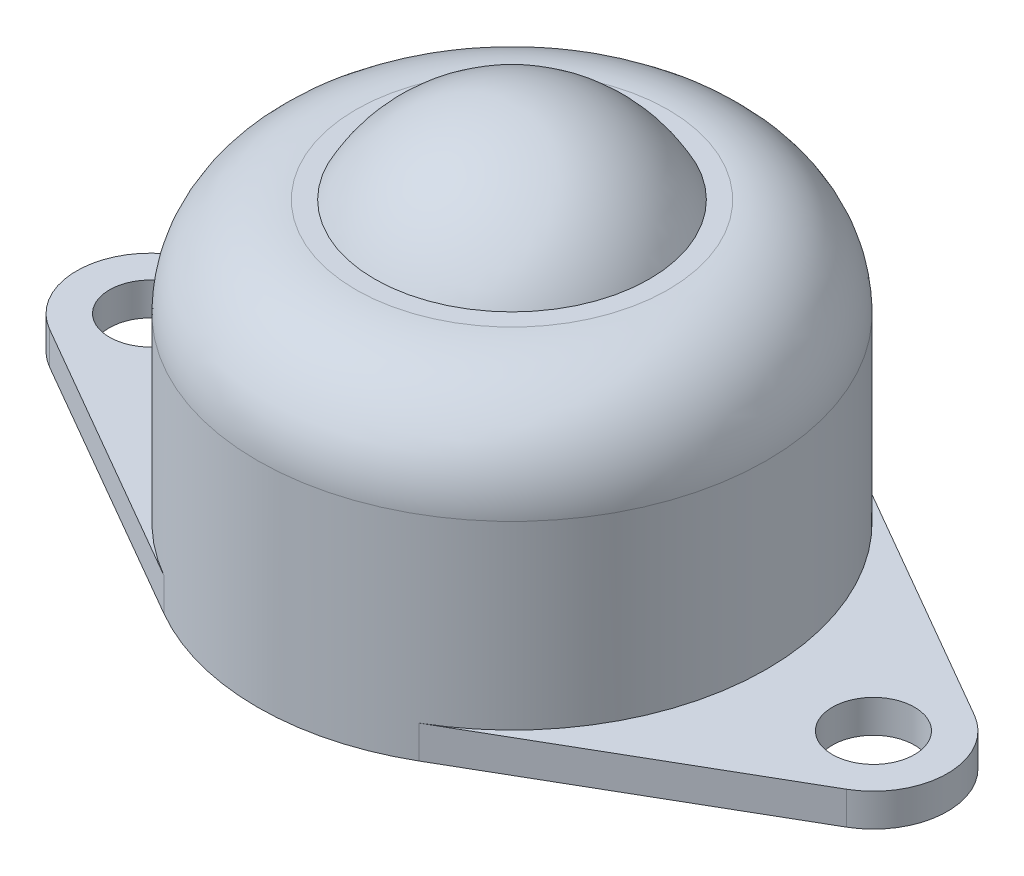
from build123d import *

# Parameters (mm, degrees)
EXTRUDE_START   = -2
SKETCH_2_R      = 2.5
EXTRUDE_1_DEPTH = 2


with BuildPart() as part:
    # 草图1 → 旋转1 (revolve)
    with BuildSketch(Plane.XY, mode=Mode.PRIVATE) as revolve_1_sk:
        with BuildLine():
            Line((0, -14.5), (15.5, -14.5))
            Line((15.5, -14.5), (15.5, -1.5))
            ThreePointArc((15.5, -1.5), (13.742640687, 2.742640687), (9.5, 4.5))
            Line((9.5, 4.5), (8.366600265, 4.5))
            ThreePointArc((8.366600265, 4.5), (4.873397172, 8.154753215), (0, 9.5))
            Line((0, 9.5), (0, -14.5))
        make_face()
    revolve(revolve_1_sk.sketch.rotate(Axis((0, 9.5, 0), (0, -1, 0)), 90), axis=Axis((0, 9.5, 0), (0, -1, 0)))

    # 草图2 → 凸台-拉伸1 (add)
    with BuildSketch(Plane.XZ.offset(14.5).offset(EXTRUDE_START)):
        with BuildLine():
            Line((-24.25, 3.897114317), (-7.75, 13.423393759))
            ThreePointArc((-7.75, 13.423393759), (0, 15.5), (7.75, 13.423393759))
            Line((7.75, 13.423393759), (24.25, 3.897114317))
            ThreePointArc((24.25, 3.897114317), (26.5, 0), (24.25, -3.897114317))
            Line((24.25, -3.897114317), (7.75, -13.423393759))
            ThreePointArc((7.75, -13.423393759), (0, -15.5), (-7.75, -13.423393759))
            Line((-7.75, -13.423393759), (-24.25, -3.897114317))
            ThreePointArc((-24.25, -3.897114317), (-26.5, 0), (-24.25, 3.897114317))
        make_face()
        with Locations(Location((-22, 0, 0), (0, 0, 270))):
            Circle(SKETCH_2_R, mode=Mode.SUBTRACT)
        with Locations(Location((22, 0, 0), (0, 0, 90))):
            Circle(SKETCH_2_R, mode=Mode.SUBTRACT)
    extrude(amount=EXTRUDE_1_DEPTH)


solid = part.part
